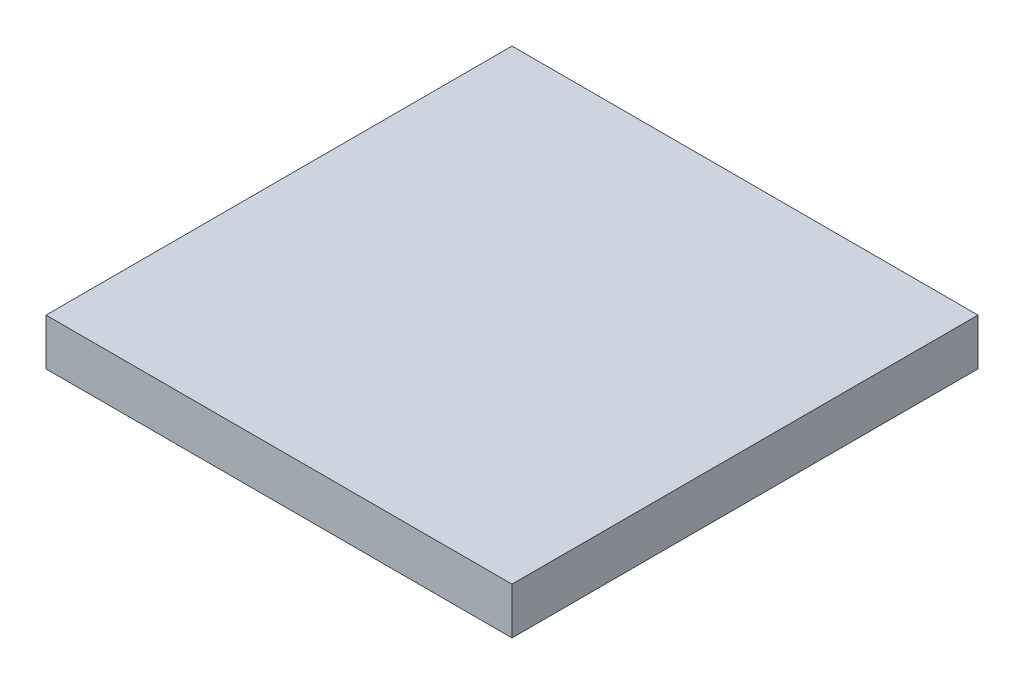
from build123d import *

# Parameters (mm, degrees)
SKETCH_1_W      = 20
SKETCH_1_H      = 20
EXTRUDE_1_DEPTH = 2


with BuildPart() as part:
    # 草图1 → 凸台-拉伸1 (new body)
    with BuildSketch(Plane(origin=(0, 0, 0), x_dir=(1, 0, 0), z_dir=(0, 1, 0))):
        with Locations((10, 10)):
            Rectangle(SKETCH_1_W, SKETCH_1_H)
    extrude(amount=EXTRUDE_1_DEPTH)


solid = part.part
